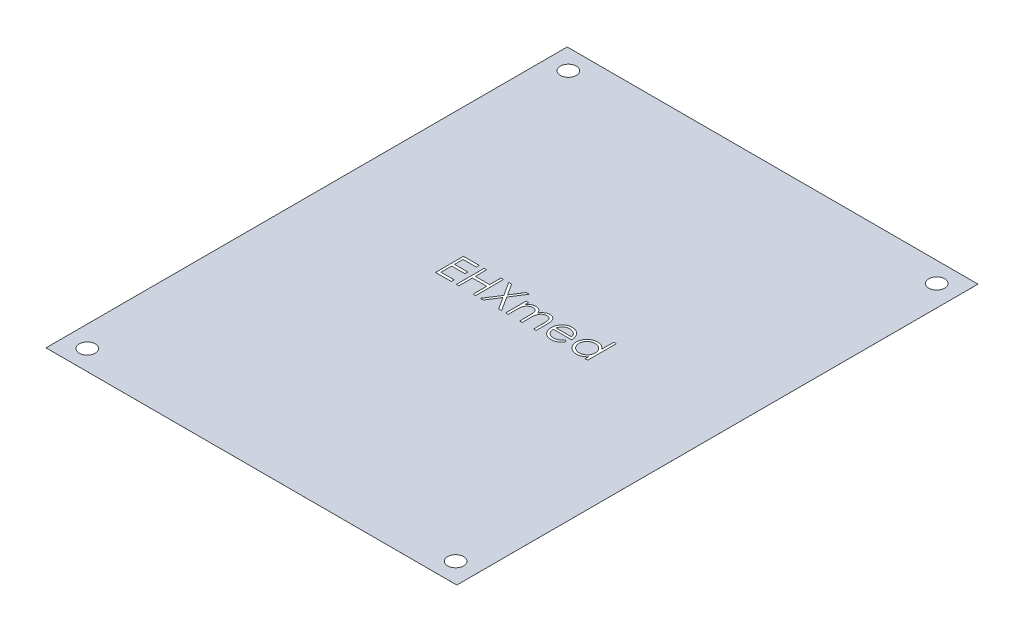
from build123d import *

# Parameters (mm, degrees)
SKETCH2_W           = 93.472
SKETCH2_H           = 118.5799
BOSS_EXTRUDE1_DEPTH = 0.00254
SKETCH3_R           = 1.8288
CUT_EXTRUDE1_DEPTH  = 76.495376504
CUT_EXTRUDE2_DEPTH  = 2.54


with BuildPart() as part:
    # Sketch2 → Boss-Extrude1 (new body)
    with BuildSketch(Plane(origin=(0, 0, 0), x_dir=(1, 0, 0), z_dir=(0, 1, 0))):
        Rectangle(SKETCH2_W, SKETCH2_H)
    extrude(amount=BOSS_EXTRUDE1_DEPTH)

    # Sketch3 → Cut-Extrude1 (cut, through all)
    with BuildSketch(Plane(origin=(0, 0.00254, 0), x_dir=(1, 0, 0), z_dir=(0, 1, 0))):
        with Locations(Location((-41.91, 54.737, 0), (0, 0, 270))):
            Circle(SKETCH3_R)
        with Locations(Location((41.91, 54.737, 0), (0, 0, 270))):
            Circle(SKETCH3_R)
        with Locations(Location((41.91, -54.737, 0), (0, 0, 270))):
            Circle(SKETCH3_R)
        with Locations(Location((-41.91, -54.737, 0), (0, 0, 270))):
            Circle(SKETCH3_R)
    extrude(amount=-CUT_EXTRUDE1_DEPTH, mode=Mode.SUBTRACT)

    # Sketch5 → Cut-Extrude2 (cut)
    # profile 1 of 6: a face of its own
    with BuildSketch(Plane(origin=(0, 0.00254, 0), x_dir=(1, 0, 0), z_dir=(0, 1, 0))):
        Polygon((-17.28043017, 6.240856852), (-13.698378888, 6.240856852), (-13.698378888, 5.589574801), (-16.710558375, 5.589574801), (-16.710558375, 3.635728647), (-13.698378888, 3.635728647), (-13.698378888, 2.984446596), (-16.710558375, 2.984446596), (-16.710558375, 0.542138904), (-13.698378888, 0.542138904), (-13.698378888, -0.109143148), (-17.28043017, -0.109143148), align=None)
    # profile 2 of 6: a face of its own
    with BuildSketch(Plane(origin=(0, 0.00254, 0), x_dir=(1, 0, 0), z_dir=(0, 1, 0))):
        Polygon((-12.558635298, 6.240856852), (-11.988763503, 6.240856852), (-11.988763503, 3.635728647), (-8.732353247, 3.635728647), (-8.732353247, 6.240856852), (-8.162481452, 6.240856852), (-8.162481452, -0.109143148), (-8.732353247, -0.109143148), (-8.732353247, 2.984446596), (-11.988763503, 2.984446596), (-11.988763503, -0.109143148), (-12.558635298, -0.109143148), align=None)
    # profile 3 of 6: a face of its own
    with BuildSketch(Plane(origin=(0, 0.00254, 0), x_dir=(1, 0, 0), z_dir=(0, 1, 0))):
        Polygon((-6.982032734, 6.240856852), (-6.324390506, 6.240856852), (-4.661840426, 3.643360859), (-2.999290346, 6.240856852), (-2.341648118, 6.240856852), (-4.332383295, 3.129458615), (-2.260237862, -0.109143148), (-2.91788009, -0.109143148), (-4.661840426, 2.615556372), (-6.405800763, -0.109143148), (-7.06344299, -0.109143148), (-4.990025522, 3.129458615), align=None)
    # profile 4 of 6: a face of its own
    with BuildSketch(Plane(origin=(0, 0.00254, 0), x_dir=(1, 0, 0), z_dir=(0, 1, 0))):
        with BuildLine():
            Line((-1.324019913, 4.531241468), (-0.754148118, 4.531241468))
            Line((-0.754148118, 4.531241468), (-0.754148118, 3.724771115))
            add(Edge.make_bspline(
                [(-0.754148118, 3.724771115), (-0.702832952, 3.795324336), (-0.604508174, 3.93051107), (-0.44328049, 4.108656299), (-0.282215258, 4.25983738), (-0.166221836, 4.339199447), (-0.110498279, 4.377325202)],
                knots=[0, 0, 0, 0, 1.134379233, 2.173579362, 3.122582517, 4, 4, 4, 4], degree=3))
            add(Edge.make_bspline(
                [(-0.110498279, 4.377325202), (-0.03454382, 4.41362065), (0.116038084, 4.485577423), (0.354470106, 4.558572594), (0.598445578, 4.603430992), (0.763197623, 4.60956577), (0.846072234, 4.612651724)],
                knots=[0, 0, 0, 0, 1.014936303, 2.012140481, 3.000054389, 4, 4, 4, 4], degree=3))
            add(Edge.make_bspline(
                [(0.846072234, 4.612651724), (0.902120956, 4.610755268), (1.013038364, 4.607002283), (1.177383785, 4.582581934), (1.336784409, 4.540370449), (1.490298434, 4.481574304), (1.634934523, 4.4103696), (1.767539211, 4.326822273), (1.886600274, 4.233029008), (1.992057539, 4.124754372), (2.086888485, 3.998957972), (2.174117249, 3.85224712), (2.254717277, 3.681327507), (2.299387366, 3.557291068), (2.322905167, 3.491988663)],
                knots=[0, 0, 0, 0, 1.009824226, 1.998387844, 2.986035974, 3.974953746, 4.955485308, 5.885931332, 6.793869504, 7.679848016, 8.601185859, 9.625726857, 10.749998409, 12, 12, 12, 12], degree=3))
            add(Edge.make_bspline(
                [(2.322905167, 3.491988663), (2.347781294, 3.536845824), (2.39673402, 3.625118417), (2.47893139, 3.750046978), (2.565051535, 3.866899301), (2.655828401, 3.975768099), (2.75094158, 4.076115753), (2.850838692, 4.168274032), (2.954951081, 4.252638705), (3.099717002, 4.351196437), (3.288062732, 4.455882866), (3.525531169, 4.546648757), (3.77254648, 4.602739448), (3.94021859, 4.6093258), (4.02488834, 4.612651724)],
                knots=[0, 0, 0, 0, 0.86119277, 1.694706429, 2.50939023, 3.298075842, 4.073795165, 4.829715201, 5.57930267, 6.321991688, 7.768977793, 9.186738141, 10.579381044, 12, 12, 12, 12], degree=3))
            add(Edge.make_bspline(
                [(4.02488834, 4.612651724), (4.102687565, 4.609717624), (4.254948203, 4.603975304), (4.476612671, 4.558884002), (4.683335661, 4.481454556), (4.874701213, 4.375802102), (5.047348303, 4.243034155), (5.197419321, 4.085066406), (5.324002695, 3.903016219), (5.40669537, 3.731762182), (5.462784492, 3.580568078), (5.497367017, 3.451742379), (5.527919035, 3.309953133), (5.553285009, 3.155030801), (5.571824382, 2.986428126), (5.585559823, 2.804421022), (5.594856356, 2.608868034), (5.595513259, 2.47394777), (5.595851882, 2.404398519)],
                knots=[0, 0, 0, 0, 1.209669288, 2.367440248, 3.500751976, 4.631527125, 5.755587489, 6.87532382, 8.007944318, 9.190864318, 9.82315674, 10.514484317, 11.263564316, 12.079023757, 12.955305781, 13.901327259, 14.918167583, 16, 16, 16, 16], degree=3))
            Line((5.595851882, 2.404398519), (5.595851882, -0.109143148))
            Line((5.595851882, -0.109143148), (5.025980087, -0.109143148))
            Line((5.025980087, -0.109143148), (5.025980087, 2.40694259))
            add(Edge.make_bspline(
                [(5.025980087, 2.40694259), (5.025838785, 2.466307059), (5.025567224, 2.580396542), (5.020680207, 2.744140275), (5.011472137, 2.89339858), (5.000705006, 3.02796794), (4.985748381, 3.148162171), (4.966433619, 3.253739845), (4.945972685, 3.345531474), (4.911980244, 3.447287589), (4.857646212, 3.559537828), (4.77488307, 3.680593458), (4.670615877, 3.785968624), (4.550219593, 3.877441856), (4.413153129, 3.951816033), (4.262087132, 4.00493108), (4.097959495, 4.037811159), (3.984343865, 4.041087787), (3.92566959, 4.042779929)],
                knots=[0, 0, 0, 0, 1.253487763, 2.409012846, 3.458416907, 4.410876679, 5.259312806, 6.014470957, 6.676830364, 7.243083969, 8.276244668, 9.299465089, 10.325150304, 11.392391894, 12.482080715, 13.603491619, 14.762376348, 16, 16, 16, 16], degree=3))
            add(Edge.make_bspline(
                [(3.92566959, 4.042779929), (3.853696958, 4.040210615), (3.711451677, 4.035132674), (3.503814866, 3.983291504), (3.304296022, 3.905131621), (3.118848566, 3.791861306), (2.948255289, 3.65613756), (2.801480341, 3.494757579), (2.680227661, 3.31218614), (2.598124019, 3.143191409), (2.546254858, 2.991391132), (2.512006739, 2.858771614), (2.485366872, 2.708037913), (2.460383198, 2.540202894), (2.444076891, 2.354111281), (2.42925713, 2.150623896), (2.422324993, 1.929128712), (2.421355332, 1.77559172), (2.420851882, 1.695874881)],
                knots=[0, 0, 0, 0, 1.090531906, 2.155305635, 3.229839962, 4.33261226, 5.44038871, 6.529323825, 7.629011124, 8.757537029, 9.370236727, 10.061839251, 10.834451254, 11.692844982, 12.636905849, 13.66920014, 14.789842145, 16, 16, 16, 16], degree=3))
            Line((2.420851882, 1.695874881), (2.420851882, -0.109143148))
            Line((2.420851882, -0.109143148), (1.850980087, -0.109143148))
            Line((1.850980087, -0.109143148), (1.850980087, 2.250482253))
            add(Edge.make_bspline(
                [(1.850980087, 2.250482253), (1.850835976, 2.317054417), (1.850558722, 2.445132569), (1.845703118, 2.62879938), (1.836474533, 2.795860769), (1.825805538, 2.946122567), (1.810456357, 3.079311692), (1.793021503, 3.196142182), (1.772431881, 3.296321144), (1.738341662, 3.406200428), (1.686245412, 3.527251246), (1.602446708, 3.656321384), (1.497930098, 3.769293504), (1.375337223, 3.865738662), (1.2374412, 3.945461064), (1.085071315, 4.002900899), (0.919599545, 4.036327825), (0.805521421, 4.040588668), (0.746853484, 4.042779929)],
                knots=[0, 0, 0, 0, 1.320475261, 2.540461679, 3.643808994, 4.639130445, 5.527981419, 6.302341397, 6.981980563, 7.553956391, 8.582137848, 9.585246428, 10.591171744, 11.620968678, 12.668337649, 13.738356861, 14.836885341, 16, 16, 16, 16], degree=3))
            add(Edge.make_bspline(
                [(0.746853484, 4.042779929), (0.677881215, 4.040003238), (0.540421931, 4.03446939), (0.338488358, 3.984659493), (0.143478617, 3.906637814), (-0.041496336, 3.798397857), (-0.211448005, 3.664323814), (-0.360234433, 3.50663536), (-0.485315872, 3.327294971), (-0.568286451, 3.160082205), (-0.621805111, 3.012084978), (-0.657356647, 2.886262544), (-0.687908539, 2.746562094), (-0.71061255, 2.592552621), (-0.732529875, 2.425237207), (-0.743107722, 2.243782347), (-0.753397556, 2.048343703), (-0.753891794, 1.913410656), (-0.754148118, 1.843430971)],
                knots=[0, 0, 0, 0, 1.098833095, 2.189935336, 3.297829714, 4.440610912, 5.596351641, 6.740013378, 7.886572111, 9.072425424, 9.705826452, 10.395263256, 11.156850408, 11.985370555, 12.878090359, 13.847760091, 14.883794034, 16, 16, 16, 16], degree=3))
            Line((-0.754148118, 1.843430971), (-0.754148118, -0.109143148))
            Line((-0.754148118, -0.109143148), (-1.324019913, -0.109143148))
            Line((-1.324019913, -0.109143148), (-1.324019913, 4.531241468))
        make_face()
    # profile 5 of 6: a face of its own
    with BuildSketch(Plane(origin=(0, 0.00254, 0), x_dir=(1, 0, 0), z_dir=(0, 1, 0))):
        with BuildLine():
            Line((10.706889542, 1.356241468), (11.213159574, 1.090386099))
            add(Edge.make_bspline(
                [(11.213159574, 1.090386099), (11.172816037, 1.018824627), (11.09432349, 0.87959434), (10.959339276, 0.688310822), (10.817839373, 0.516229966), (10.663436459, 0.367949022), (10.500750042, 0.238678652), (10.32887794, 0.125580027), (10.14692537, 0.029207855), (9.954883727, -0.051986017), (9.751140255, -0.114414671), (9.535201219, -0.158509472), (9.306652934, -0.185765974), (9.149996293, -0.188932158), (9.069780167, -0.190553404)],
                knots=[0, 0, 0, 0, 1.120438281, 2.179929193, 3.190490725, 4.156257408, 5.095198341, 6.022838206, 6.959905092, 7.901321166, 8.864066838, 9.862729781, 10.905609505, 12, 12, 12, 12], degree=3))
            add(Edge.make_bspline(
                [(9.069780167, -0.190553404), (8.980622579, -0.1884721), (8.806701954, -0.184412079), (8.553536984, -0.149410037), (8.315177183, -0.092310186), (8.091635949, -0.012544132), (7.88346072, 0.091645442), (7.69023774, 0.21857193), (7.510950886, 0.367583306), (7.351249821, 0.539970282), (7.207478777, 0.724450405), (7.08061336, 0.916684652), (6.974554878, 1.11618936), (6.888280857, 1.321694453), (6.818603459, 1.53190466), (6.770041011, 1.748732609), (6.742047039, 1.971591454), (6.73775726, 2.122353763), (6.735595471, 2.198328808)],
                knots=[0, 0, 0, 0, 1.145258523, 2.234067595, 3.276747158, 4.290159414, 5.277019952, 6.260822364, 7.254936242, 8.264827045, 9.274100331, 10.257902744, 11.220704747, 12.172965371, 13.118907548, 14.062713208, 15.023725156, 16, 16, 16, 16], degree=3))
            add(Edge.make_bspline(
                [(6.735595471, 2.198328808), (6.737517056, 2.269620857), (6.741325384, 2.410912284), (6.765329813, 2.620036915), (6.807871716, 2.823288536), (6.866248761, 3.020836035), (6.941634593, 3.212348649), (7.033858762, 3.397942936), (7.143064933, 3.577421404), (7.227379641, 3.690638518), (7.269850279, 3.74766775)],
                knots=[0, 0, 0, 0, 1.024358464, 2.0301432, 3.019427413, 4.004406732, 4.986367066, 5.972626655, 6.978780325, 8, 8, 8, 8], degree=3))
            add(Edge.make_bspline(
                [(7.269850279, 3.74766775), (7.327377075, 3.8163727), (7.440608364, 3.951606201), (7.632117751, 4.129294307), (7.839490965, 4.278145156), (8.060129201, 4.401529532), (8.296596804, 4.495280291), (8.545715089, 4.565144047), (8.810320652, 4.604292725), (8.99121441, 4.609822366), (9.083772555, 4.612651724)],
                knots=[0, 0, 0, 0, 1.030682036, 2.02871468, 2.997146059, 3.962720338, 4.930598197, 5.918074684, 6.934738563, 8, 8, 8, 8], degree=3))
            add(Edge.make_bspline(
                [(9.083772555, 4.612651724), (9.178927496, 4.610195093), (9.365599799, 4.605375742), (9.637800933, 4.560696537), (9.895358233, 4.489844045), (10.138168634, 4.389779311), (10.366256752, 4.260675552), (10.578140014, 4.100761069), (10.777442044, 3.914945396), (10.893390465, 3.77204643), (10.952392346, 3.69933041)],
                knots=[0, 0, 0, 0, 1.056321875, 2.072262726, 3.055038591, 4.01806755, 4.982017516, 5.957941055, 6.960871419, 8, 8, 8, 8], degree=3))
            add(Edge.make_bspline(
                [(10.952392346, 3.69933041), (10.992536934, 3.644532484), (11.072558896, 3.535301383), (11.17279292, 3.357190855), (11.259801337, 3.170844491), (11.329348281, 2.973250095), (11.385662804, 2.766748856), (11.42640589, 2.549864525), (11.450299341, 2.322661686), (11.454995977, 2.167854936), (11.457390343, 2.088933776)],
                knots=[0, 0, 0, 0, 0.94817472, 1.890038105, 2.849395472, 3.817997239, 4.812318967, 5.836947057, 6.897266129, 8, 8, 8, 8], degree=3))
            Line((11.457390343, 2.088933776), (7.305467266, 2.088933776))
            add(Edge.make_bspline(
                [(7.305467266, 2.088933776), (7.308260552, 2.027791505), (7.313753436, 1.907557695), (7.339362339, 1.731624989), (7.379727971, 1.564033353), (7.436458985, 1.406039834), (7.505160261, 1.255580889), (7.589317205, 1.113772622), (7.689718967, 0.981260949), (7.801707021, 0.85686057), (7.926361323, 0.746078904), (8.057502879, 0.646924967), (8.197009775, 0.563820527), (8.343782012, 0.496365584), (8.497582251, 0.443558411), (8.658458948, 0.407512508), (8.82609553, 0.383369614), (8.940369648, 0.380685078), (8.998546192, 0.379318391)],
                knots=[0, 0, 0, 0, 1.094153842, 2.151609401, 3.174256925, 4.172055639, 5.149267565, 6.128595816, 7.11444997, 8.118368179, 9.117203808, 10.09244225, 11.054858984, 12.015122123, 12.976791628, 13.957293641, 14.960065497, 16, 16, 16, 16], degree=3))
            add(Edge.make_bspline(
                [(8.998546192, 0.379318391), (9.055426132, 0.380421579), (9.168286842, 0.382610517), (9.336363826, 0.403895555), (9.501716969, 0.438313055), (9.663661896, 0.485284895), (9.818911859, 0.542574326), (9.962685928, 0.611703797), (10.094911463, 0.68817548), (10.218495102, 0.775641605), (10.338366761, 0.882699315), (10.457279558, 1.016295552), (10.584781486, 1.17429721), (10.664591176, 1.293215775), (10.706889542, 1.356241468)],
                knots=[0, 0, 0, 0, 0.99110716, 1.966546729, 2.947904876, 3.932708344, 4.903319531, 5.828989031, 6.710028674, 7.56322171, 8.463672341, 9.504779593, 10.677557249, 12, 12, 12, 12], degree=3))
        make_face()
        with BuildLine():
            add(Edge.make_bspline(
                [(10.887518548, 2.65880557), (10.866660387, 2.734393927), (10.82651514, 2.879877181), (10.742629164, 3.081337083), (10.648156512, 3.260385132), (10.536357085, 3.415651037), (10.409685968, 3.553543125), (10.263372565, 3.674045415), (10.099296016, 3.781845648), (9.918304432, 3.872836611), (9.72664005, 3.950288212), (9.525968816, 4.002222351), (9.321212544, 4.037799663), (9.182720339, 4.041112746), (9.113029366, 4.042779929)],
                knots=[0, 0, 0, 0, 1.154881502, 2.222775134, 3.210006277, 4.132804581, 5.035138423, 5.962687519, 6.919655026, 7.923214229, 8.944639381, 9.960483929, 10.97369054, 12, 12, 12, 12], degree=3))
            add(Edge.make_bspline(
                [(9.113029366, 4.042779929), (9.056152527, 4.041670182), (8.943718975, 4.039476446), (8.778072751, 4.018666354), (8.618996726, 3.984267779), (8.465317133, 3.937159929), (8.319047843, 3.874370036), (8.177180192, 3.800740467), (8.043321473, 3.71085788), (7.95960798, 3.642352529), (7.917316224, 3.607743872)],
                knots=[0, 0, 0, 0, 1.04873581, 2.073130211, 3.073294108, 4.04793562, 5.032784715, 6.005352987, 6.992311501, 8, 8, 8, 8], degree=3))
            add(Edge.make_bspline(
                [(7.917316224, 3.607743872), (7.887029841, 3.58035847), (7.825737584, 3.524937093), (7.74383978, 3.429452675), (7.665425494, 3.326489127), (7.59406301, 3.212107258), (7.52860796, 3.087609559), (7.467357716, 2.954046135), (7.412228083, 2.810403456), (7.381210854, 2.710304887), (7.365252923, 2.65880557)],
                knots=[0, 0, 0, 0, 0.879870761, 1.780643979, 2.707998968, 3.669668524, 4.684282772, 5.740141944, 6.837334558, 8, 8, 8, 8], degree=3))
            Line((7.365252923, 2.65880557), (10.887518548, 2.65880557))
        make_face(mode=Mode.SUBTRACT)
    # profile 6 of 6: a face of its own
    with BuildSketch(Plane(origin=(0, 0.00254, 0), x_dir=(1, 0, 0), z_dir=(0, 1, 0))):
        with BuildLine():
            Line((17.318928805, 6.403677365), (17.318928805, -0.109143148))
            Line((17.318928805, -0.109143148), (16.74905701, -0.109143148))
            Line((16.74905701, -0.109143148), (16.74905701, 0.693511099))
            add(Edge.make_bspline(
                [(16.74905701, 0.693511099), (16.684797204, 0.620867836), (16.559393385, 0.479103594), (16.349950214, 0.293897367), (16.127939377, 0.140810983), (15.894438408, 0.017167565), (15.649658167, -0.075709452), (15.394141265, -0.14172434), (15.127783474, -0.184167441), (14.945897059, -0.188405652), (14.853724478, -0.190553404)],
                knots=[0, 0, 0, 0, 1.074387032, 2.096679803, 3.090159297, 4.057316773, 5.018401886, 5.985159533, 6.978961417, 8, 8, 8, 8], degree=3))
            add(Edge.make_bspline(
                [(14.853724478, -0.190553404), (14.771776904, -0.188328414), (14.610172661, -0.183940636), (14.372448478, -0.149900457), (14.143681111, -0.0952349), (13.923654387, -0.019214715), (13.713792066, 0.081624776), (13.512297319, 0.202349611), (13.320214006, 0.346115117), (13.140469928, 0.510467683), (12.974949014, 0.688984303), (12.82969499, 0.879385509), (12.708585831, 1.080847975), (12.607312256, 1.290820983), (12.529304603, 1.510920908), (12.474923866, 1.740386627), (12.440923342, 1.978946826), (12.436537377, 2.141397104), (12.43431342, 2.223769513)],
                knots=[0, 0, 0, 0, 1.033919861, 2.038935746, 3.024066025, 3.998881131, 4.97069526, 5.957263378, 6.95902576, 7.993208707, 9.027059324, 10.027763471, 11.009749337, 11.988697705, 12.965288445, 13.950418724, 14.960734635, 16, 16, 16, 16], degree=3))
            add(Edge.make_bspline(
                [(12.43431342, 2.223769513), (12.436586668, 2.304439375), (12.441080757, 2.463919341), (12.47456017, 2.698467836), (12.530859286, 2.924379537), (12.609867524, 3.140927134), (12.711180785, 3.348372654), (12.834421743, 3.546862813), (12.979599298, 3.736944434), (13.146971522, 3.914147946), (13.328281748, 4.077833918), (13.522244731, 4.220090329), (13.724035541, 4.34294804), (13.936784146, 4.440290776), (14.157341608, 4.519047294), (14.387671431, 4.573535679), (14.626815295, 4.605643676), (14.789176616, 4.610293262), (14.871532971, 4.612651724)],
                knots=[0, 0, 0, 0, 1.020392517, 2.01726096, 2.990465484, 3.961182959, 4.928053699, 5.906110375, 6.912531644, 7.948652711, 8.985773172, 9.998621852, 10.987621588, 11.969261332, 12.953316658, 13.946091881, 14.958173133, 16, 16, 16, 16], degree=3))
            add(Edge.make_bspline(
                [(14.871532971, 4.612651724), (14.96626918, 4.609808564), (15.152225828, 4.604227757), (15.424184575, 4.557589063), (15.681427811, 4.47927927), (15.925436517, 4.372070803), (16.15475599, 4.232732297), (16.371067181, 4.06445467), (16.570608353, 3.862475419), (16.688667231, 3.710780136), (16.74905701, 3.633184577)],
                knots=[0, 0, 0, 0, 1.031072012, 2.023879775, 2.993683497, 3.952812103, 4.918022106, 5.908088563, 6.929940113, 8, 8, 8, 8], degree=3))
            Line((16.74905701, 3.633184577), (16.74905701, 6.403677365))
            Line((16.74905701, 6.403677365), (17.318928805, 6.403677365))
        make_face()
        with BuildLine():
            add(Edge.make_bspline(
                [(14.879165183, 4.042779929), (14.795863456, 4.039816044), (14.631439096, 4.033965805), (14.390059263, 3.988293892), (14.159076355, 3.912303271), (13.93964562, 3.808377536), (13.735233284, 3.677696828), (13.552546196, 3.519633747), (13.390090152, 3.338500879), (13.253459444, 3.135115621), (13.142079542, 2.917078227), (13.063762213, 2.689159604), (13.012110864, 2.455470573), (13.006833977, 2.296969701), (13.004185215, 2.217409336)],
                knots=[0, 0, 0, 0, 1.031046209, 2.035121221, 3.029706178, 4.034933723, 5.034054252, 6.02443088, 7.017295772, 8.038157696, 9.050218397, 10.03989886, 11.016116709, 12, 12, 12, 12], degree=3))
            add(Edge.make_bspline(
                [(13.004185215, 2.217409336), (13.007568664, 2.138324428), (13.014322301, 1.980464596), (13.062855703, 1.746456978), (13.144280617, 1.518484645), (13.255391216, 1.298482557), (13.394522664, 1.094222832), (13.555792076, 0.909637181), (13.740759015, 0.750906071), (13.945641778, 0.618032187), (14.164459096, 0.510694471), (14.394572086, 0.436008239), (14.631655029, 0.387788551), (14.792858549, 0.382156143), (14.874077042, 0.379318391)],
                knots=[0, 0, 0, 0, 0.979072187, 1.954306742, 2.945804271, 3.96968567, 4.997920485, 5.998718438, 6.996577872, 8.005894225, 9.015743152, 10.005417472, 10.995077863, 12, 12, 12, 12], degree=3))
            add(Edge.make_bspline(
                [(14.874077042, 0.379318391), (14.956529983, 0.38233004), (15.120520704, 0.388319911), (15.362616645, 0.434187349), (15.597557506, 0.509967883), (15.822142906, 0.615013442), (16.031359316, 0.745201787), (16.219134037, 0.897614653), (16.377913008, 1.074876144), (16.512519599, 1.269687709), (16.618066427, 1.483250902), (16.694948706, 1.710642934), (16.740403649, 1.95187172), (16.746132673, 2.116724844), (16.74905701, 2.200872878)],
                knots=[0, 0, 0, 0, 1.01762866, 2.023962475, 3.030623092, 4.058876274, 5.077231937, 6.066672613, 7.034107872, 8.005628644, 8.981990164, 9.965428785, 10.961468474, 12, 12, 12, 12], degree=3))
            add(Edge.make_bspline(
                [(16.74905701, 2.200872878), (16.747315919, 2.264985799), (16.743888901, 2.391180317), (16.717707725, 2.576468813), (16.67606093, 2.753785716), (16.617375736, 2.923317452), (16.540284405, 3.084126694), (16.447306316, 3.237368087), (16.336806429, 3.382244628), (16.210563537, 3.516761343), (16.072378098, 3.639455067), (15.926156574, 3.748973047), (15.770166562, 3.838941249), (15.607031367, 3.913401841), (15.436467945, 3.97265487), (15.257088392, 4.012183972), (15.070799373, 4.039326269), (14.943715816, 4.041616588), (14.879165183, 4.042779929)],
                knots=[0, 0, 0, 0, 1.050140795, 2.067009409, 3.05949893, 4.030605086, 5.00011959, 5.97591094, 6.962425594, 7.979863591, 8.993523472, 9.986985069, 10.967611495, 11.937549037, 12.921786183, 13.919465291, 14.943216303, 16, 16, 16, 16], degree=3))
        make_face(mode=Mode.SUBTRACT)
    extrude(amount=-CUT_EXTRUDE2_DEPTH, mode=Mode.SUBTRACT)


with BuildPart() as cut_extrude2_piece_1:
    # of the separate pieces the step leaves, piece 1, a body of its own (cut_extrude2_pieces)
    add(part.part.solids().sort_by_distance((-46.736, 0, 59.28995))[0])


with BuildPart() as cut_extrude2_piece_2:
    # of the separate pieces the step leaves, piece 2, a body of its own (cut_extrude2_pieces)
    add(part.part.solids().sort_by_distance((13.004185215, 0, -2.217409336))[0])


with BuildPart() as cut_extrude2_piece_3:
    # of the separate pieces the step leaves, piece 3, a body of its own (cut_extrude2_pieces)
    add(part.part.solids().sort_by_distance((9.113029366, 0, -4.042779929))[0])


solid = Compound([cut_extrude2_piece_1.part, cut_extrude2_piece_2.part, cut_extrude2_piece_3.part])
